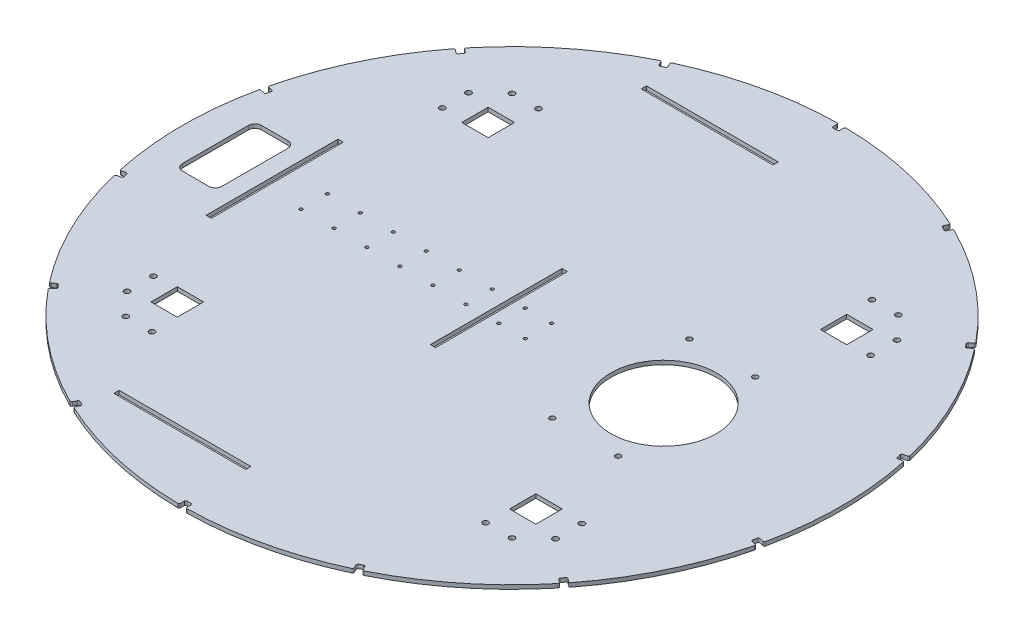
from build123d import *

# Parameters (mm, degrees)
SKETCH1_R                = 250
BOSS_EXTRUDE1_DEPTH      = 3
CUT_EXTRUDE5_DEPTH       = 4
FILLET1_R                = 1
CIRPATTERN1_COUNT        = 14
FILLET1_OF_CIRPATTERN1_R = 1
SKETCH12_R               = 40
CUT_EXTRUDE6_DEPTH       = 10
SKETCH13_R               = 2.1
CUT_EXTRUDE7_DEPTH       = 3
SKETCH14_R               = 2
CUT_EXTRUDE8_DEPTH       = 4
SKETCH15_W               = 20
SKETCH15_H               = 20
CUT_EXTRUDE9_DEPTH       = 4
SKETCH17_W               = 4
SKETCH17_H               = 100
CUT_EXTRUDE11_DEPTH      = 10
CUT_EXTRUDE12_DEPTH      = 10
SKETCH20_R               = 1.2
CUT_EXTRUDE14_DEPTH      = 14
SKETCH21_W               = 100
SKETCH21_H               = 4
CUT_EXTRUDE15_DEPTH      = 14
SKETCH22_W               = 4
SKETCH22_H               = 100
CUT_EXTRUDE16_DEPTH      = 14


with BuildPart() as part:
    # Sketch1 → Boss-Extrude1 (new body)
    with BuildSketch(Plane(origin=(0, 0, 0), x_dir=(1, 0, 0), z_dir=(0, 1, 0))):
        Circle(SKETCH1_R)
    extrude(amount=BOSS_EXTRUDE1_DEPTH)

    # Sketch11 → Cut-Extrude5 (cut)
    with BuildSketch(Plane(origin=(0, 3, 0), x_dir=(1, 0, 0), z_dir=(0, 1, 0))):
        with BuildLine():
            Line((1.5, 245), (-1.5, 245))
            ThreePointArc((-1.5, 245), (-2.207106781, 245.292893219), (-2.5, 246))
            Line((-2.5, 246), (-2.5, 255))
            Line((-2.5, 255), (2.5, 255))
            Line((2.5, 255), (2.5, 246))
            ThreePointArc((2.5, 246), (2.207106781, 245.292893219), (1.5, 245))
        make_face()
    cut_extrude5 = extrude(amount=-CUT_EXTRUDE5_DEPTH, mode=Mode.SUBTRACT)

    # Fillet1
    fillet1_edges = [part.edges().sort_by_distance(p)[0] for p in [
        (2.5, 1.5, -249.987499687),
        (-2.5, 1.5, -249.987499687),
    ]]
    fillet(fillet1_edges, radius=FILLET1_R)

    # CirPattern1: Cut-Extrude5 ×14 about axis
    cirpattern1_axis = Axis((0, 3, 0), (0, -1, 0))
    for i in range(1, CIRPATTERN1_COUNT):
        add(cut_extrude5.rotate(cirpattern1_axis, i * 360 / CIRPATTERN1_COUNT), mode=Mode.SUBTRACT)

    # Fillet1 of CirPattern1
    fillet1_of_cirpattern1_edges = [part.edges().sort_by_distance(p)[0] for p in [
        (110.717933267, 1.5, -224.146245235),
        (106.213088927, 1.5, -226.315663931),
        (197.006821984, 1.5, -153.910077941),
        (193.889372974, 1.5, -157.819235353),
        (244.276093477, 1.5, -53.190132127),
        (243.163488807, 1.5, -58.064771688),
        (243.163488807, 1.5, 58.064771688),
        (244.276093477, 1.5, 53.190132127),
        (193.889372974, 1.5, 157.819235353),
        (197.006821984, 1.5, 153.910077941),
        (106.213088927, 1.5, 226.315663931),
        (110.717933267, 1.5, 224.146245235),
        (-2.5, 1.5, 249.987499687),
        (2.5, 1.5, 249.987499687),
        (-110.717933267, 1.5, 224.146245235),
        (-106.213088927, 1.5, 226.315663931),
        (-197.006821984, 1.5, 153.910077941),
        (-193.889372974, 1.5, 157.819235353),
        (-244.276093477, 1.5, 53.190132127),
        (-243.163488807, 1.5, 58.064771688),
        (-243.163488807, 1.5, -58.064771688),
        (-244.276093477, 1.5, -53.190132127),
        (-193.889372974, 1.5, -157.819235353),
        (-197.006821984, 1.5, -153.910077941),
        (-106.213088927, 1.5, -226.315663931),
        (-110.717933267, 1.5, -224.146245235),
    ]]
    fillet(fillet1_of_cirpattern1_edges, radius=FILLET1_OF_CIRPATTERN1_R)

    # Sketch12 → Cut-Extrude6 (cut)
    with BuildSketch(Plane(origin=(0, 3, 0), x_dir=(1, 0, 0), z_dir=(0, 1, 0))):
        with Locations((115, 0)):
            Circle(SKETCH12_R)
    extrude(amount=-CUT_EXTRUDE6_DEPTH, mode=Mode.SUBTRACT)

    # Sketch13 → Cut-Extrude7 (cut)
    with BuildSketch(Plane(origin=(0, 3, 0), x_dir=(1, 0, 0), z_dir=(0, 1, 0))):
        with Locations((-162, -130)):
            Circle(SKETCH13_R)
        with Locations((-162, -110)):
            Circle(SKETCH13_R)
        with Locations((126, -146)):
            Circle(SKETCH13_R)
        with Locations((146, -146)):
            Circle(SKETCH13_R)
        with Locations((-146, -147)):
            Circle(SKETCH13_R)
        with Locations((-126, -147)):
            Circle(SKETCH13_R)
        with Locations((163, -130)):
            Circle(SKETCH13_R)
        with Locations((163, -110)):
            Circle(SKETCH13_R)
        with Locations((-163, 110)):
            Circle(SKETCH13_R)
        with Locations((-163, 130)):
            Circle(SKETCH13_R)
        with Locations((-146, 146)):
            Circle(SKETCH13_R)
        with Locations((-126, 146)):
            Circle(SKETCH13_R)
        with Locations((126, 147)):
            Circle(SKETCH13_R)
        with Locations((146, 147)):
            Circle(SKETCH13_R)
        with Locations((162, 110)):
            Circle(SKETCH13_R)
        with Locations((162, 130)):
            Circle(SKETCH13_R)
    extrude(amount=-CUT_EXTRUDE7_DEPTH, mode=Mode.SUBTRACT)

    # Sketch14 → Cut-Extrude8 (cut)
    with BuildSketch(Plane(origin=(0, 0, 0), x_dir=(-1, 0, 0), z_dir=(0, -1, 0))):
        with Locations((-82.5, 52)):
            Circle(SKETCH14_R)
        with Locations((-132.5, 52)):
            Circle(SKETCH14_R)
        with Locations((-82.5, -52)):
            Circle(SKETCH14_R)
        with Locations((-132.5, -52)):
            Circle(SKETCH14_R)
    extrude(amount=-CUT_EXTRUDE8_DEPTH, mode=Mode.SUBTRACT)

    # Sketch15 → Cut-Extrude9 (cut)
    with BuildSketch(Plane(origin=(0, 3, 0), x_dir=(1, 0, 0), z_dir=(0, 1, 0))):
        with Locations((-136, 117.9)):
            Rectangle(SKETCH15_W, SKETCH15_H)
        with Locations((136, 117.9)):
            Rectangle(SKETCH15_W, SKETCH15_H)
        with Locations((136, -117.9)):
            Rectangle(SKETCH15_W, SKETCH15_H)
        with Locations((-136, -117.9)):
            Rectangle(SKETCH15_W, SKETCH15_H)
    extrude(amount=-CUT_EXTRUDE9_DEPTH, mode=Mode.SUBTRACT)

    # Sketch17 → Cut-Extrude11 (cut)
    with BuildSketch(Plane(origin=(0, 3, 0), x_dir=(1, 0, 0), z_dir=(0, 1, 0))):
        with Locations((-180, 0)):
            Rectangle(SKETCH17_W, SKETCH17_H)
    extrude(amount=-CUT_EXTRUDE11_DEPTH, mode=Mode.SUBTRACT)

    # Sketch18 → Cut-Extrude12 (cut)
    with BuildSketch(Plane(origin=(0, 3, 0), x_dir=(1, 0, 0), z_dir=(0, 1, 0))):
        with BuildLine():
            Line((-220, -30), (-200, -30))
            ThreePointArc((-200, -30), (-196.464466094, -28.535533906), (-195, -25))
            Line((-195, -25), (-195, 25))
            ThreePointArc((-195, 25), (-196.464466094, 28.535533906), (-200, 30))
            Line((-200, 30), (-220, 30))
            ThreePointArc((-220, 30), (-223.535533906, 28.535533906), (-225, 25))
            Line((-225, 25), (-225, -25))
            ThreePointArc((-225, -25), (-223.535533906, -28.535533906), (-220, -30))
        make_face()
    extrude(amount=-CUT_EXTRUDE12_DEPTH, mode=Mode.SUBTRACT)

    # Sketch20 → Cut-Extrude14 (cut)
    with BuildSketch(Plane(origin=(0, 3, 0), x_dir=(1, 0, 0), z_dir=(0, 1, 0))):
        with Locations((0, 10)):
            Circle(SKETCH20_R)
        with Locations((20, 10)):
            Circle(SKETCH20_R)
        with Locations((-25, 10)):
            Circle(SKETCH20_R)
        with Locations((-50, 10)):
            Circle(SKETCH20_R)
        with Locations((-75, 10)):
            Circle(SKETCH20_R)
        with Locations((-100, 10)):
            Circle(SKETCH20_R)
        with Locations((-125, 10)):
            Circle(SKETCH20_R)
        with Locations((-150, 10)):
            Circle(SKETCH20_R)
        with Locations((-150, -10)):
            Circle(SKETCH20_R)
        with Locations((-125, -10)):
            Circle(SKETCH20_R)
        with Locations((-100, -10)):
            Circle(SKETCH20_R)
        with Locations((-75, -10)):
            Circle(SKETCH20_R)
        with Locations((-50, -10)):
            Circle(SKETCH20_R)
        with Locations((-25, -10)):
            Circle(SKETCH20_R)
        with Locations((20, -10)):
            Circle(SKETCH20_R)
        with Locations((0, -10)):
            Circle(SKETCH20_R)
    extrude(amount=-CUT_EXTRUDE14_DEPTH, mode=Mode.SUBTRACT)

    # Sketch21 → Cut-Extrude15 (cut)
    with BuildSketch(Plane(origin=(0, 3, 0), x_dir=(1, 0, 0), z_dir=(0, 1, 0))):
        with Locations((-50, 200)):
            Rectangle(SKETCH21_W, SKETCH21_H)
        with Locations((-50, -200)):
            Rectangle(SKETCH21_W, SKETCH21_H)
    extrude(amount=-CUT_EXTRUDE15_DEPTH, mode=Mode.SUBTRACT)

    # Sketch22 → Cut-Extrude16 (cut)
    with BuildSketch(Plane(origin=(0, 3, 0), x_dir=(1, 0, 0), z_dir=(0, 1, 0))):
        with Locations((-10, 0)):
            Rectangle(SKETCH22_W, SKETCH22_H)
    extrude(amount=-CUT_EXTRUDE16_DEPTH, mode=Mode.SUBTRACT)


solid = part.part
